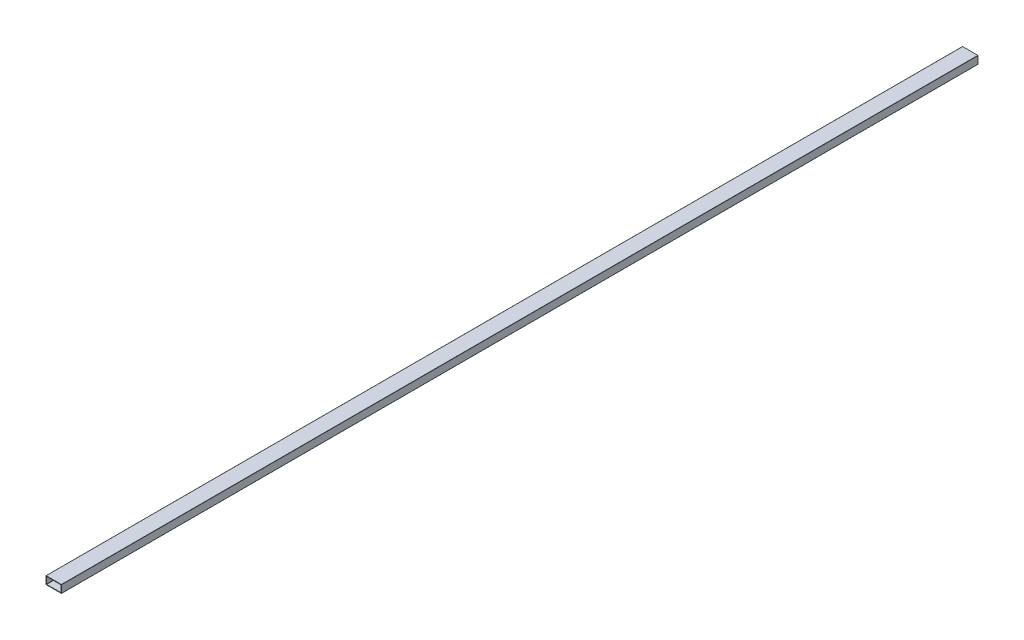
from build123d import *

# Parameters (mm, degrees)
CROQUIS1_W              = 101.6
CROQUIS1_H              = 50.8
CROQUIS1_W_2            = 95.52
CROQUIS1_H_2            = 44.72
SALIENTE_EXTRUIR1_DEPTH = 6000
REDONDEO1_R             = 1


with BuildPart() as part:
    # Croquis1 → Saliente-Extruir1 (new body)
    with BuildSketch(Plane.XY):
        Rectangle(CROQUIS1_W, CROQUIS1_H)
        Rectangle(CROQUIS1_W_2, CROQUIS1_H_2, mode=Mode.SUBTRACT)
    extrude(amount=-SALIENTE_EXTRUIR1_DEPTH)

    # Redondeo1
    redondeo1_edges = [part.edges().sort_by_distance(p)[0] for p in [
        (47.76, -22.36, -3000),
        (-47.76, -22.36, -3000),
        (-47.76, 22.36, -3000),
        (47.76, 22.36, -3000),
        (50.8, -25.4, -3000),
        (-50.8, -25.4, -3000),
        (-50.8, 25.4, -3000),
        (50.8, 25.4, -3000),
    ]]
    fillet(redondeo1_edges, radius=REDONDEO1_R)


solid = part.part
